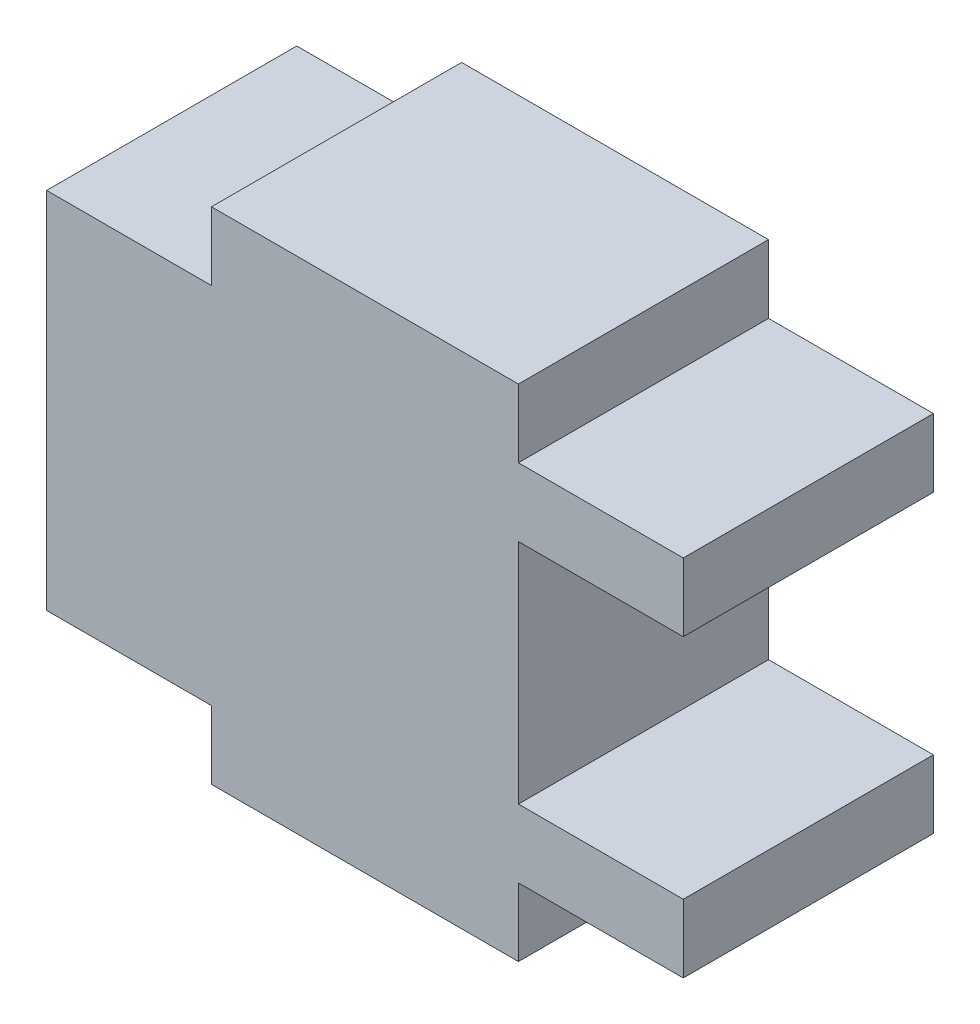
from build123d import *

# Parameters (mm, degrees)
COMPONENT_OUTLINE_DEPTH = 1.1


with BuildPart() as part:
    # 草图1 → Component_Outline (new body)
    with BuildSketch(Plane.XY):
        Polygon((-1.4, -0.8), (-0.675, -0.8), (-0.675, -1.1), (0.675, -1.1), (0.675, -0.8), (1.4, -0.8), (1.4, -0.5), (0.675, -0.5), (0.675, 0.5), (1.4, 0.5), (1.4, 0.8), (0.675, 0.8), (0.675, 1.1), (-0.675, 1.1), (-0.675, 0.8), (-1.4, 0.8), align=None)
    extrude(amount=COMPONENT_OUTLINE_DEPTH)


solid = part.part
